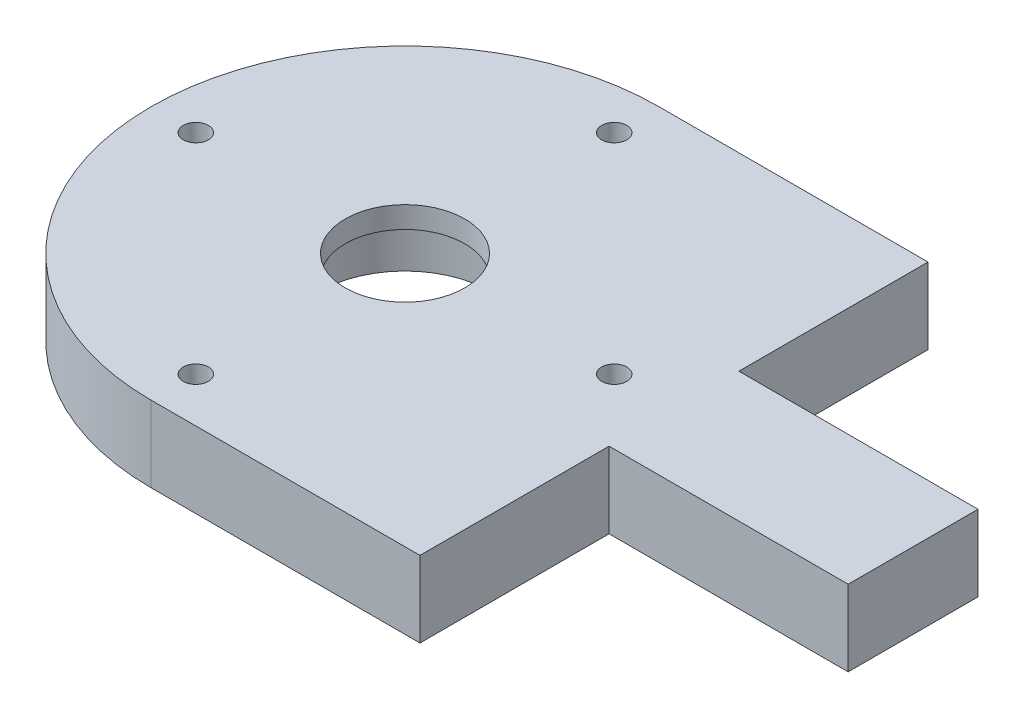
from build123d import *

# Parameters (mm, degrees)
SKETCH1_R           = 2.1
SKETCH1_R_2         = 10
BOSS_EXTRUDE1_DEPTH = 12.7
SKETCH2_R           = 14.35
CUT_EXTRUDE1_DEPTH  = 8.1
CUT_EXTRUDE2_START  = -12.7
SKETCH3_R           = 14.35
CUT_EXTRUDE2_DEPTH  = 9.1
CUT_EXTRUDE3_START  = -12.7
CUT_EXTRUDE3_DEPTH  = 5
CUT_EXTRUDE4_DEPTH  = 20


with BuildPart() as part:
    # Sketch1 → Boss-Extrude1 (new body)
    with BuildSketch(Plane(origin=(0, 0, 0), x_dir=(1, 0, 0), z_dir=(0, 1, 0))):
        with BuildLine():
            Line((0, 42.5), (-137.9, 42.5))
            ThreePointArc((-137.9, 42.5), (-180.4, 0), (-137.9, -42.5))
            Line((-137.9, -42.5), (0, -42.5))
            ThreePointArc((0, -42.5), (42.5, 0), (0, 42.5))
        make_face()
        with Locations(Location((-102.9, 0, 0), (0, 0, 270))):
            Circle(SKETCH1_R, mode=Mode.SUBTRACT)
        with Locations(Location((-137.9, 35, 0), (0, 0, 270))):
            Circle(SKETCH1_R, mode=Mode.SUBTRACT)
        with Locations(Location((-137.9, -35, 0), (0, 0, 270))):
            Circle(SKETCH1_R, mode=Mode.SUBTRACT)
        with Locations(Location((-172.9, 0, 0), (0, 0, 270))):
            Circle(SKETCH1_R, mode=Mode.SUBTRACT)
        with Locations(Location((-137.9, 0, 0), (0, 0, 270))):
            Circle(SKETCH1_R_2, mode=Mode.SUBTRACT)
        with Locations(Location((0, 35, 0), (0, 0, 270))):
            Circle(SKETCH1_R, mode=Mode.SUBTRACT)
        with Locations(Location((0, -35, 0), (0, 0, 270))):
            Circle(SKETCH1_R, mode=Mode.SUBTRACT)
        with Locations(Location((-17.67766953, -17.67766953, 0), (0, 0, 270))):
            Circle(SKETCH1_R, mode=Mode.SUBTRACT)
        with Locations(Location((17.67766953, -17.67766953, 0), (0, 0, 270))):
            Circle(SKETCH1_R, mode=Mode.SUBTRACT)
        with Locations(Location((-35, 0, 0), (0, 0, 270))):
            Circle(SKETCH1_R, mode=Mode.SUBTRACT)
        with Locations(Location((-17.67766953, 17.67766953, 0), (0, 0, 270))):
            Circle(SKETCH1_R, mode=Mode.SUBTRACT)
        with Locations(Location((0, 0, 0), (0, 0, 270))):
            Circle(SKETCH1_R_2, mode=Mode.SUBTRACT)
        with Locations(Location((35, 0, 0), (0, 0, 270))):
            Circle(SKETCH1_R, mode=Mode.SUBTRACT)
        with Locations(Location((17.67766953, 17.67766953, 0), (0, 0, 270))):
            Circle(SKETCH1_R, mode=Mode.SUBTRACT)
    extrude(amount=-BOSS_EXTRUDE1_DEPTH)

    # Sketch2 → Cut-Extrude1 (cut)
    with BuildSketch(Plane(origin=(0, 0, 0), x_dir=(1, 0, 0), z_dir=(0, 1, 0))):
        with Locations(Location((0, 0, 0), (0, 0, 270))):
            Circle(SKETCH2_R)
    extrude(amount=-CUT_EXTRUDE1_DEPTH, mode=Mode.SUBTRACT)

    # Sketch3 → Cut-Extrude2 (cut)
    with BuildSketch(Plane(origin=(0, 0, 0), x_dir=(1, 0, 0), z_dir=(0, 1, 0)).offset(CUT_EXTRUDE2_START)):
        with Locations(Location((-137.9, 0, 0), (0, 0, 270))):
            Circle(SKETCH3_R)
    extrude(amount=CUT_EXTRUDE2_DEPTH, mode=Mode.SUBTRACT)

    # Sketch4 → Cut-Extrude3 (cut)
    with BuildSketch(Plane(origin=(0, 0, 0), x_dir=(1, 0, 0), z_dir=(0, 1, 0)).offset(CUT_EXTRUDE3_START)):
        with BuildLine():
            Line((-162.9, -4.05), (-172.9, -4.05))
            ThreePointArc((-172.9, -4.05), (-176.95, 0), (-172.9, 4.05))
            Line((-172.9, 4.05), (-162.9, 4.05))
            ThreePointArc((-162.9, 4.05), (-158.85, 0), (-162.9, -4.05))
        make_face()
        with BuildLine():
            Line((-137.9, -30.95), (-127.9, -30.95))
            ThreePointArc((-127.9, -30.95), (-123.85, -35), (-127.9, -39.05))
            Line((-127.9, -39.05), (-137.9, -39.05))
            ThreePointArc((-137.9, -39.05), (-141.95, -35), (-137.9, -30.95))
        make_face()
        with BuildLine():
            Line((-92.9, -4.05), (-102.9, -4.05))
            ThreePointArc((-102.9, -4.05), (-106.95, 0), (-102.9, 4.05))
            Line((-102.9, 4.05), (-92.9, 4.05))
            ThreePointArc((-92.9, 4.05), (-88.85, 0), (-92.9, -4.05))
        make_face()
        with BuildLine():
            Line((-137.9, 39.05), (-127.9, 39.05))
            ThreePointArc((-127.9, 39.05), (-123.85, 35), (-127.9, 30.95))
            Line((-127.9, 30.95), (-137.9, 30.95))
            ThreePointArc((-137.9, 30.95), (-141.95, 35), (-137.9, 39.05))
        make_face()
    extrude(amount=CUT_EXTRUDE3_DEPTH, mode=Mode.SUBTRACT)

    # Sketch6 → Cut-Extrude4 (cut)
    with BuildSketch(Plane(origin=(0, 0, 0), x_dir=(1, 0, 0), z_dir=(0, 1, 0))):
        Polygon((-92.9, 10.860556918), (-52.9, 10.860556918), (-52.9, -10.860556918), (-92.9, -10.860556918), (-92.9, -58.166636569), (47.985280952, -58.166636569), (47.985280952, 58.166636569), (-92.9, 58.166636569), align=None)
    extrude(amount=-CUT_EXTRUDE4_DEPTH, mode=Mode.SUBTRACT)


solid = part.part
